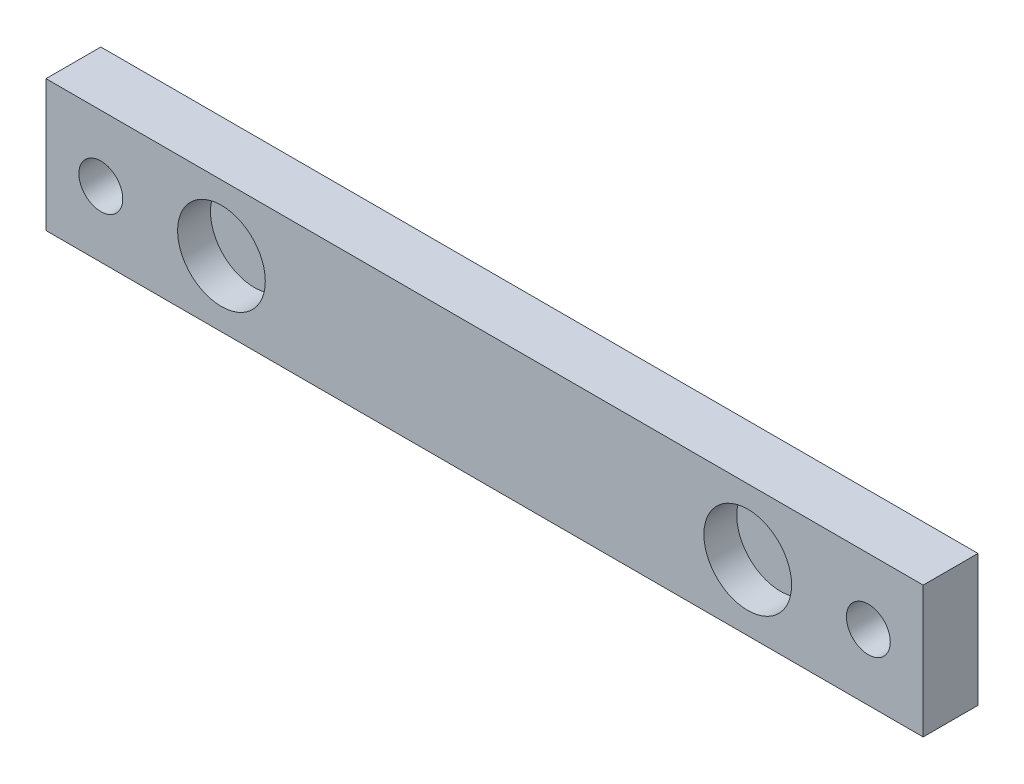
from build123d import *

# Parameters (mm, degrees)
SKETCH1_W           = 80
SKETCH1_H           = 12
SKETCH1_R           = 4
SKETCH1_R_2         = 2
BOSS_EXTRUDE1_DEPTH = 5
SKETCH2_R           = 4
BOSS_EXTRUDE2_DEPTH = 2


with BuildPart() as part:
    # Sketch1 → Boss-Extrude1 (new body)
    with BuildSketch(Plane.XY):
        with Locations((-10, 0)):
            Rectangle(SKETCH1_W, SKETCH1_H)
        with Locations((-34, 0)):
            Circle(SKETCH1_R, mode=Mode.SUBTRACT)
        with Locations((14, 0)):
            Circle(SKETCH1_R, mode=Mode.SUBTRACT)
        with Locations((-45, 0)):
            Circle(SKETCH1_R_2, mode=Mode.SUBTRACT)
        with Locations((25, 0)):
            Circle(SKETCH1_R_2, mode=Mode.SUBTRACT)
    extrude(amount=BOSS_EXTRUDE1_DEPTH)

    # Sketch2 → Boss-Extrude2 (add)
    with BuildSketch(Plane(origin=(0, 0, 0), x_dir=(-1, 0, 0), z_dir=(0, 0, -1))):
        with Locations((34, 0)):
            Circle(SKETCH2_R)
        with Locations((-14, 0)):
            Circle(SKETCH2_R)
    extrude(amount=-BOSS_EXTRUDE2_DEPTH)


solid = part.part
